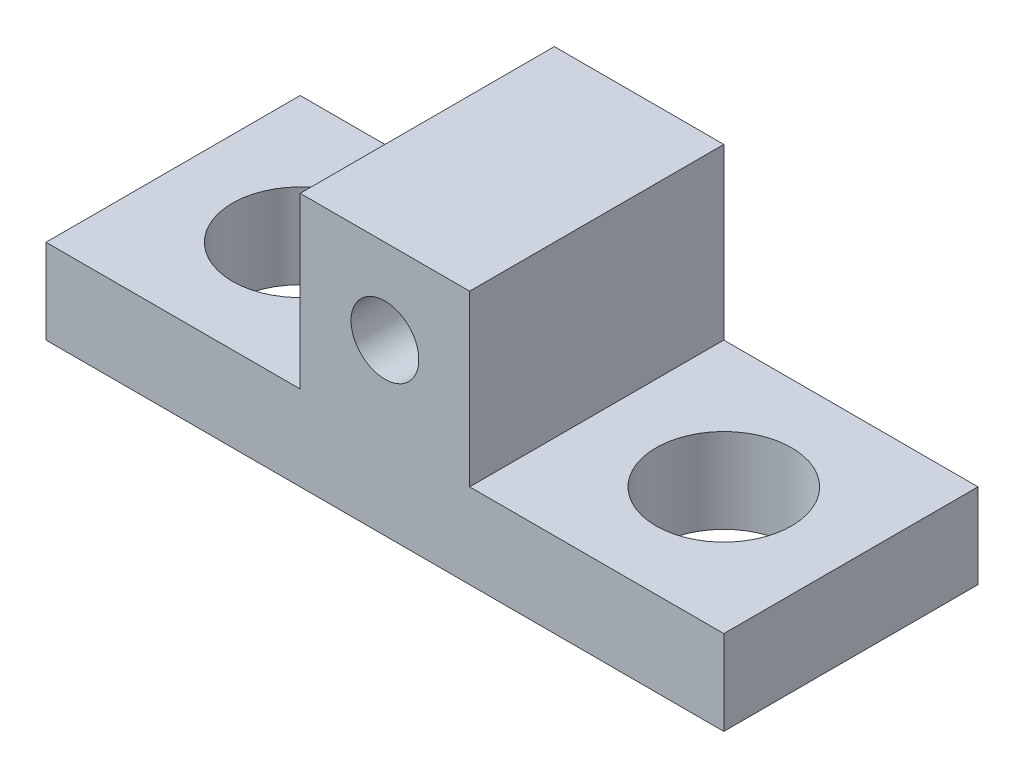
from build123d import *

# Parameters (mm, degrees)
SKETCH_1_W          = 40
SKETCH_1_H          = 15
EXTRUDE_3_DEPTH     = 5
SKETCH_2_W          = 10
SKETCH_2_H          = 15
EXTRUDE_4_DEPTH     = 10
SKETCH_4_R          = 2
CUT_EXTRUDE_1_DEPTH = 30.154759474
SKETCH_8_R          = 4
CUT_EXTRUDE_3_DEPTH = 24.58495283


with BuildPart() as part:
    # 草图1 → 凸台-拉伸3 (new body)
    with BuildSketch(Plane(origin=(0, 0, 0), x_dir=(1, 0, 0), z_dir=(0, 1, 0))):
        Rectangle(SKETCH_1_W, SKETCH_1_H)
    extrude(amount=EXTRUDE_3_DEPTH)

    # 草图2 → 凸台-拉伸4 (add)
    with BuildSketch(Plane(origin=(0, 5, 0), x_dir=(1, 0, 0), z_dir=(0, 1, 0))):
        Rectangle(SKETCH_2_W, SKETCH_2_H)
    extrude(amount=EXTRUDE_4_DEPTH)

    # 草图4 → 切除-拉伸1 (cut, through all)
    with BuildSketch(Plane(origin=(0, 0, -7.5), x_dir=(-1, 0, 0), z_dir=(0, 0, -1))):
        with Locations((0, 10)):
            Circle(SKETCH_4_R)
    extrude(amount=-CUT_EXTRUDE_1_DEPTH, mode=Mode.SUBTRACT)

    # 草图8 → 切除-拉伸3 (cut, through all)
    with BuildSketch(Plane(origin=(0, 5, 0), x_dir=(1, 0, 0), z_dir=(0, 1, 0))):
        with Locations(Location((-12.5, 0, 0), (0, 0, 270))):
            Circle(SKETCH_8_R)
    cut_extrude_3 = extrude(amount=-CUT_EXTRUDE_3_DEPTH, mode=Mode.SUBTRACT)

    # 镜向1: 切除-拉伸3 across plane
    add(cut_extrude_3.mirror(Plane(origin=(0, 0, 0), x_dir=(0, 0, 1), z_dir=(1, 0, 0))), mode=Mode.SUBTRACT)


solid = part.part
